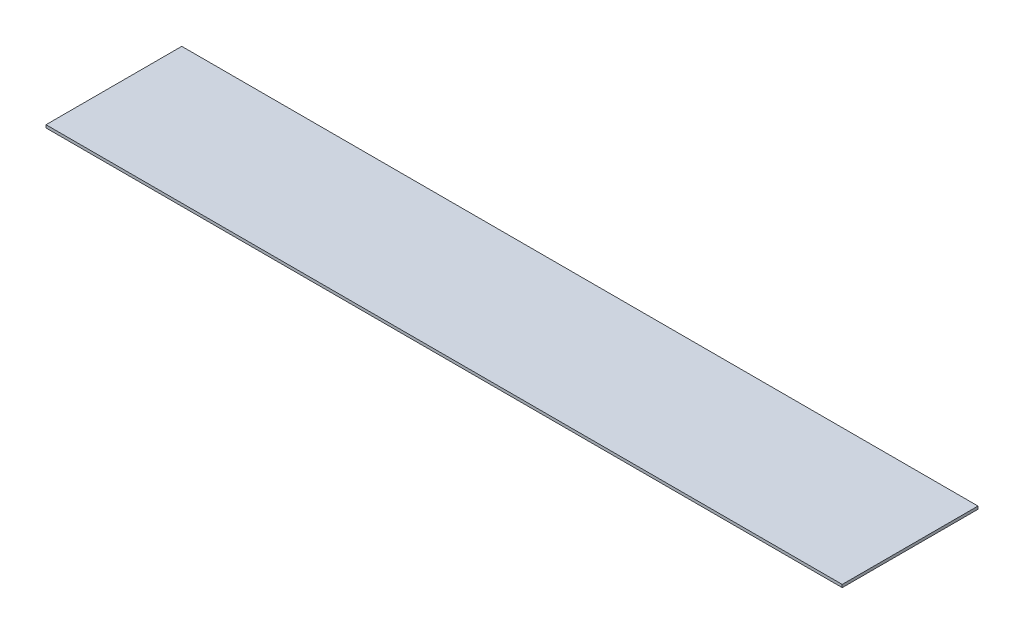
from build123d import *

# Parameters (mm, degrees)
SKETCH1_W           = 1787.525
SKETCH1_H           = 304.8
BOSS_EXTRUDE1_DEPTH = 6.35


with BuildPart() as part:
    # Sketch1 → Boss-Extrude1 (new body)
    with BuildSketch(Plane(origin=(0, 0, 0), x_dir=(1, 0, 0), z_dir=(0, 1, 0))):
        Rectangle(SKETCH1_W, SKETCH1_H)
    extrude(amount=BOSS_EXTRUDE1_DEPTH)


solid = part.part
